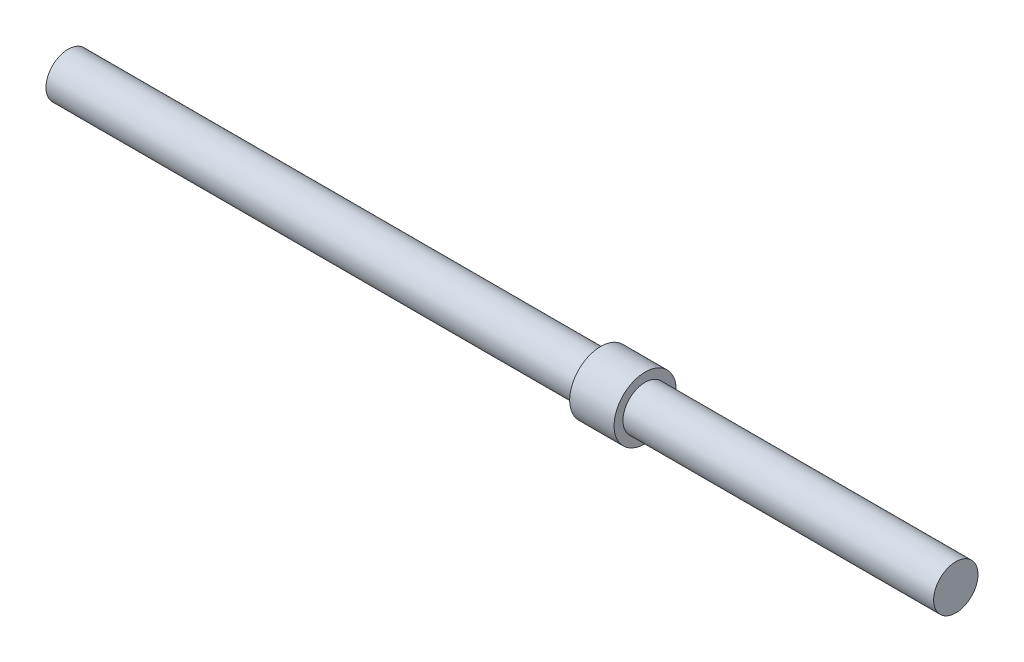
from build123d import *

# Parameters (mm, degrees)
SKETCH1_R           = 5
BOSS_EXTRUDE1_DEPTH = 100
BOSS_EXTRUDE2_START = -70
SKETCH2_R           = 7
BOSS_EXTRUDE2_DEPTH = 10


with BuildPart() as part:
    # Sketch1 → Boss-Extrude1 (new, symmetric)
    with BuildSketch(Plane(origin=(0, 0, 0), x_dir=(0, 0, -1), z_dir=(1, 0, 0))):
        Circle(SKETCH1_R)
    extrude(amount=BOSS_EXTRUDE1_DEPTH, both=True)

    # Sketch2 → Boss-Extrude2 (add)
    with BuildSketch(Plane(origin=(100, 0, 0), x_dir=(0, 0, -1), z_dir=(1, 0, 0)).offset(BOSS_EXTRUDE2_START)):
        Circle(SKETCH2_R)
    extrude(amount=-BOSS_EXTRUDE2_DEPTH)


solid = part.part
